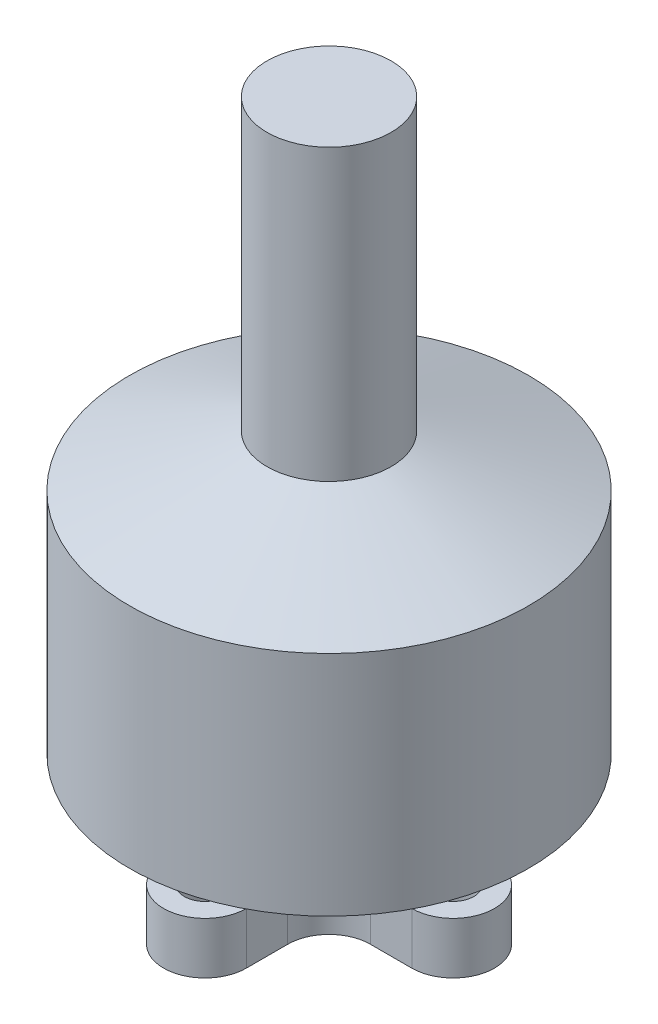
from build123d import *

# Parameters (mm, degrees)
SKETCH1_W           = 4
SKETCH1_H           = 4
SKETCH1_R           = 2
SKETCH1_R_2         = 1
BOSS_EXTRUDE1_DEPTH = 2.5
FILLET1_R           = 2


with BuildPart() as part:
    # Sketch1 → Boss-Extrude1 (new body)
    # profile 1 of 9: a face of its own
    with BuildSketch(Plane(origin=(0, 0, 0), x_dir=(1, 0, 0), z_dir=(0, 1, 0))):
        Rectangle(SKETCH1_W, SKETCH1_H)
    # profile 2 of 9: a face of its own
    with BuildSketch(Plane(origin=(0, 0, 0), x_dir=(1, 0, 0), z_dir=(0, 1, 0))):
        with BuildLine():
            ThreePointArc((-4, 0), (-4.585786438, -1.414213562), (-6, -2))
            Line((-6, -2), (-2, -2))
            Line((-2, -2), (-2, 2))
            Line((-2, 2), (-6, 2))
            ThreePointArc((-6, 2), (-4.585786438, 1.414213562), (-4, 0))
        make_face()
    # profile 3 of 9: a face of its own
    with BuildSketch(Plane(origin=(0, 0, 0), x_dir=(1, 0, 0), z_dir=(0, 1, 0))):
        with Locations((-6, 0)):
            Circle(SKETCH1_R)
        with Locations(Location((-6, 0, 0), (0, 0, 270))):
            Circle(SKETCH1_R_2, mode=Mode.SUBTRACT)
    # profile 4 of 9: a face of its own
    with BuildSketch(Plane(origin=(0, 0, 0), x_dir=(1, 0, 0), z_dir=(0, 1, 0))):
        with Locations((0, -6)):
            Circle(SKETCH1_R)
        with Locations(Location((0, -6, 0), (0, 0, 270))):
            Circle(SKETCH1_R_2, mode=Mode.SUBTRACT)
    # profile 5 of 9: a face of its own
    with BuildSketch(Plane(origin=(0, 0, 0), x_dir=(1, 0, 0), z_dir=(0, 1, 0))):
        with BuildLine():
            Line((2, -2), (-2, -2))
            Line((-2, -2), (-2, -6))
            ThreePointArc((-2, -6), (0, -4), (2, -6))
            Line((2, -6), (2, -2))
        make_face()
    # profile 6 of 9: a face of its own
    with BuildSketch(Plane(origin=(0, 0, 0), x_dir=(1, 0, 0), z_dir=(0, 1, 0))):
        with BuildLine():
            Line((-2, 6), (-2, 2))
            Line((-2, 2), (2, 2))
            Line((2, 2), (2, 6))
            ThreePointArc((2, 6), (0, 4), (-2, 6))
        make_face()
    # profile 7 of 9: a face of its own
    with BuildSketch(Plane(origin=(0, 0, 0), x_dir=(1, 0, 0), z_dir=(0, 1, 0))):
        with Locations((0, 6)):
            Circle(SKETCH1_R)
        with Locations(Location((0, 6, 0), (0, 0, 270))):
            Circle(SKETCH1_R_2, mode=Mode.SUBTRACT)
    # profile 8 of 9: a face of its own
    with BuildSketch(Plane(origin=(0, 0, 0), x_dir=(1, 0, 0), z_dir=(0, 1, 0))):
        with BuildLine():
            Line((2, 2), (2, -2))
            Line((2, -2), (6, -2))
            ThreePointArc((6, -2), (4, 0), (6, 2))
            Line((6, 2), (2, 2))
        make_face()
    # profile 9 of 9: a face of its own
    with BuildSketch(Plane(origin=(0, 0, 0), x_dir=(1, 0, 0), z_dir=(0, 1, 0))):
        with Locations((6, 0)):
            Circle(SKETCH1_R)
        with Locations(Location((6, 0, 0), (0, 0, 270))):
            Circle(SKETCH1_R_2, mode=Mode.SUBTRACT)
    extrude(amount=BOSS_EXTRUDE1_DEPTH)

    # Fillet1
    fillet1_edges = [part.edges().sort_by_distance(p)[0] for p in [
        (-2, 1.25, -2),
        (2, 1.25, -2),
        (2, 1.25, 2),
        (-2, 1.25, 2),
    ]]
    fillet(fillet1_edges, radius=FILLET1_R)

    # Sketch3 → Revolve1 (revolve)
    with BuildSketch(Plane.XY, mode=Mode.PRIVATE) as revolve1_sk:
        Polygon((0, 2.5), (3.5, 2.5), (3.5, 5), (9.65, 5), (9.65, 16), (3, 18.5), (3, 32.5), (0, 32.5), align=None)
    revolve(revolve1_sk.sketch.rotate(Axis((0, 2.5, 0), (0, 1, 0)), 90), axis=Axis((0, 2.5, 0), (0, 1, 0)))


solid = part.part
